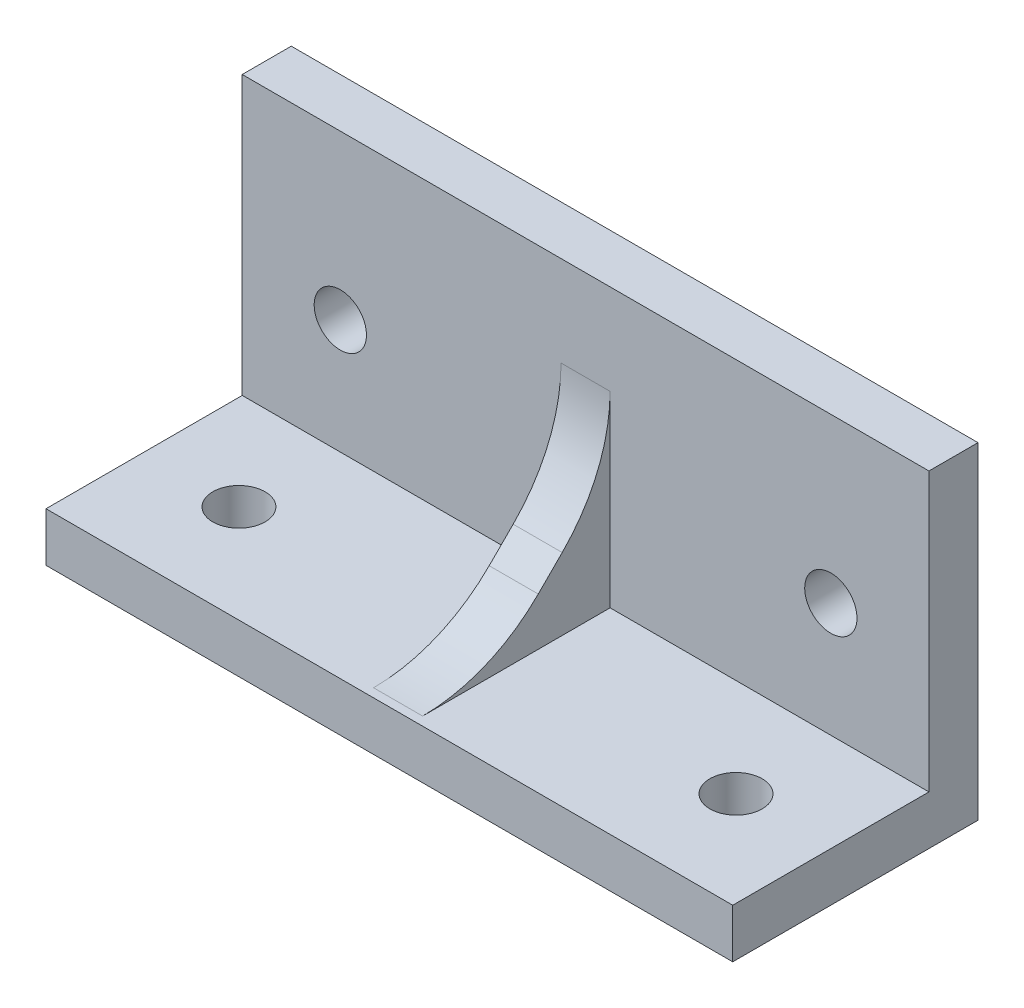
from build123d import *

# Parameters (mm, degrees)
SKETCH1_W           = 42
SKETCH1_H           = 3
BOSS_EXTRUDE1_DEPTH = 15
SKETCH2_W           = 42
SKETCH2_H           = 3
BOSS_EXTRUDE2_DEPTH = 17
CUT_EXTRUDE1_REACH  = 49.728
SKETCH6_R           = 1.6
CUT_EXTRUDE2_REACH  = 50.877
SKETCH7_R           = 1.6
BOSS_EXTRUDE3_DEPTH = 1.5
FILLET1_R           = 10


with BuildPart() as part:
    # Sketch1 → Boss-Extrude1 (new body)
    with BuildSketch(Plane.XY):
        with Locations((21, 1.5)):
            Rectangle(SKETCH1_W, SKETCH1_H)
    extrude(amount=BOSS_EXTRUDE1_DEPTH)

    # Sketch2 → Boss-Extrude2 (add)
    with BuildSketch(Plane(origin=(0, 3, 0), x_dir=(1, 0, 0), z_dir=(0, 1, 0))):
        with Locations((21, -1.5)):
            Rectangle(SKETCH2_W, SKETCH2_H)
    extrude(amount=BOSS_EXTRUDE2_DEPTH)

    # Sketch6 → Cut-Extrude1 (cut, up to next)
    with BuildSketch(Plane(origin=(0, 3, 0), x_dir=(1, 0, 0), z_dir=(0, 1, 0)), mode=Mode.PRIVATE) as cut_extrude1_sk1:
        with Locations(Location((5.8, -9, 0), (0, 0, 270))):
            Circle(SKETCH6_R)
    cut_extrude1_tool1 = extrude(cut_extrude1_sk1.sketch, amount=-CUT_EXTRUDE1_REACH, mode=Mode.PRIVATE) & part.part
    # Sketch6 → Cut-Extrude1 (cut, up to next)
    with BuildSketch(Plane(origin=(0, 3, 0), x_dir=(1, 0, 0), z_dir=(0, 1, 0)), mode=Mode.PRIVATE) as cut_extrude1_sk2:
        with Locations(Location((36.2, -9, 0), (0, 0, 270))):
            Circle(SKETCH6_R)
    cut_extrude1_tool2 = extrude(cut_extrude1_sk2.sketch, amount=-CUT_EXTRUDE1_REACH, mode=Mode.PRIVATE) & part.part
    add(cut_extrude1_tool1.solids().sort_by_distance((5.8, 3, 9))[0], mode=Mode.SUBTRACT)
    add(cut_extrude1_tool2.solids().sort_by_distance((36.2, 3, 9))[0], mode=Mode.SUBTRACT)

    # Sketch7 → Cut-Extrude2 (cut, up to next)
    with BuildSketch(Plane(origin=(0, 0, 0), x_dir=(-1, 0, 0), z_dir=(0, 0, -1)), mode=Mode.PRIVATE) as cut_extrude2_sk1:
        with Locations((-36, 10)):
            Circle(SKETCH7_R)
    cut_extrude2_tool1 = extrude(cut_extrude2_sk1.sketch, amount=-CUT_EXTRUDE2_REACH, mode=Mode.PRIVATE) & part.part
    # Sketch7 → Cut-Extrude2 (cut, up to next)
    with BuildSketch(Plane(origin=(0, 0, 0), x_dir=(-1, 0, 0), z_dir=(0, 0, -1)), mode=Mode.PRIVATE) as cut_extrude2_sk2:
        with Locations((-6, 10)):
            Circle(SKETCH7_R)
    cut_extrude2_tool2 = extrude(cut_extrude2_sk2.sketch, amount=-CUT_EXTRUDE2_REACH, mode=Mode.PRIVATE) & part.part
    add(cut_extrude2_tool1.solids().sort_by_distance((36, 10, 0))[0], mode=Mode.SUBTRACT)
    add(cut_extrude2_tool2.solids().sort_by_distance((6, 10, 0))[0], mode=Mode.SUBTRACT)

    # Sketch9 → Boss-Extrude3 (add, symmetric)
    with BuildSketch(Plane.ZY.offset(-21)):
        Polygon((3, 10.323968285), (10.323968285, 3), (3, 3), align=None)
    extrude(amount=BOSS_EXTRUDE3_DEPTH, both=True)

    # Fillet1
    fillet1_edges = [part.edges().sort_by_distance(p)[0] for p in [
        (21, 10.323968285, 3),
        (21, 3, 10.323968285),
    ]]
    fillet(fillet1_edges, radius=FILLET1_R)


solid = part.part
